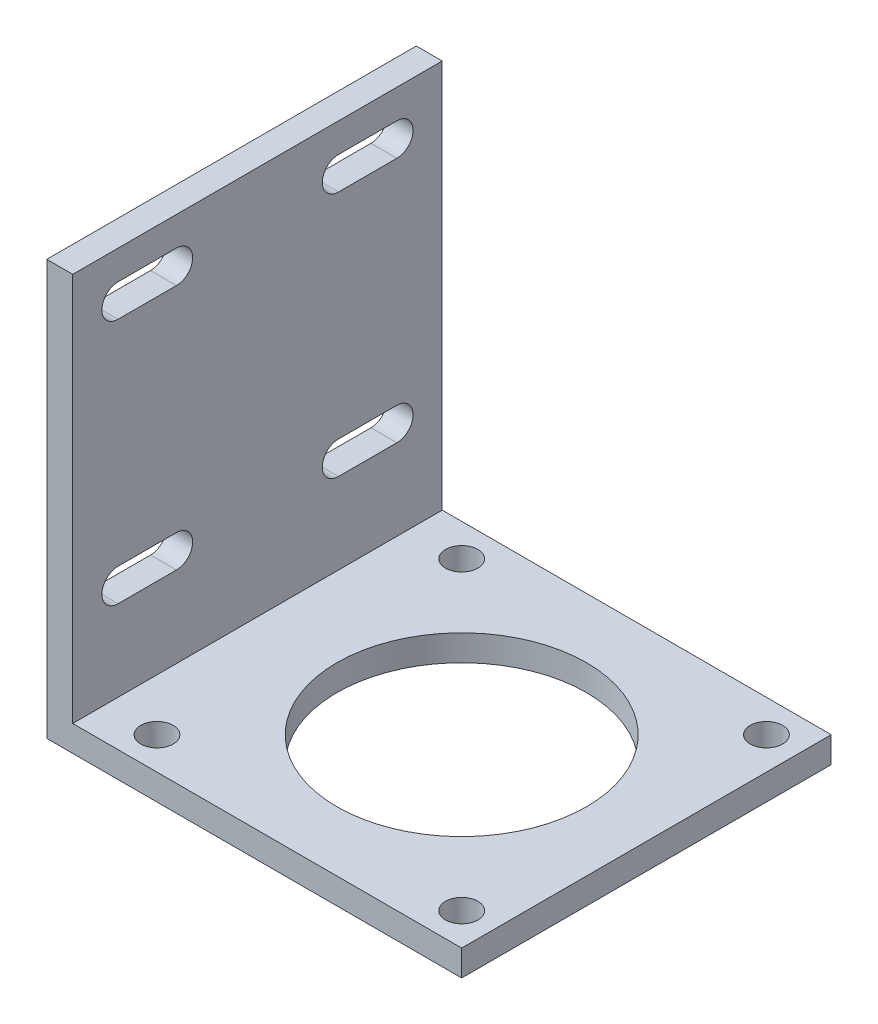
from build123d import *

# Parameters (mm, degrees)
SKETCH1_W                = 64
SKETCH1_H                = 57
BOSS_EXTRUDE1_DEPTH      = 4
SKETCH2_W                = 4
SKETCH2_H                = 57
BOSS_EXTRUDE2_DEPTH      = 60
SKETCH3_R                = 19.25
CUT_EXTRUDE1_DEPTH       = 60
F_5_0_5_DIAMETER_HOLE1_D = 5
CUT_EXTRUDE2_DEPTH       = 60


with BuildPart() as part:
    # Sketch1 → Boss-Extrude1 (new body)
    with BuildSketch(Plane(origin=(0, 0, 0), x_dir=(1, 0, 0), z_dir=(0, 1, 0))):
        Rectangle(SKETCH1_W, SKETCH1_H)
    extrude(amount=BOSS_EXTRUDE1_DEPTH)

    # Sketch2 → Boss-Extrude2 (add)
    with BuildSketch(Plane(origin=(0, 4, 0), x_dir=(1, 0, 0), z_dir=(0, 1, 0))):
        with Locations((-30, 0)):
            Rectangle(SKETCH2_W, SKETCH2_H)
    extrude(amount=BOSS_EXTRUDE2_DEPTH)

    # Sketch3 → Cut-Extrude1 (cut)
    with BuildSketch(Plane.XZ):
        with Locations(Location((3.5, 0, 0), (0, 0, 270))):
            Circle(SKETCH3_R)
    extrude(amount=-CUT_EXTRUDE1_DEPTH, mode=Mode.SUBTRACT)

    # Ø5.0 (5) Diameter Hole1 (through all)
    with Locations(Plane(origin=(0, 0, 0), x_dir=(-1, 0, 0), z_dir=(0, -1, 0))):
        with Locations((-27, -23.5), (-27, 23.5), (20, 23.5), (20, -23.5)):
            Hole(F_5_0_5_DIAMETER_HOLE1_D / 2)

    # Sketch6 → Cut-Extrude2 (cut)
    with BuildSketch(Plane.ZY.offset(32)):
        with BuildLine():
            Line((-21.5, 16.5), (-12.5, 16.5))
            ThreePointArc((-12.5, 16.5), (-10, 19), (-12.5, 21.5))
            Line((-12.5, 21.5), (-21.5, 21.5))
            ThreePointArc((-21.5, 21.5), (-24, 19), (-21.5, 16.5))
        make_face()
        with BuildLine():
            Line((12.5, 16.5), (21.5, 16.5))
            ThreePointArc((21.5, 16.5), (24, 19), (21.5, 21.5))
            Line((21.5, 21.5), (12.5, 21.5))
            ThreePointArc((12.5, 21.5), (10, 19), (12.5, 16.5))
        make_face()
        with BuildLine():
            Line((-21.5, 54.5), (-12.5, 54.5))
            ThreePointArc((-12.5, 54.5), (-10, 57), (-12.5, 59.5))
            Line((-12.5, 59.5), (-21.5, 59.5))
            ThreePointArc((-21.5, 59.5), (-24, 57), (-21.5, 54.5))
        make_face()
        with BuildLine():
            Line((12.5, 54.5), (21.5, 54.5))
            ThreePointArc((21.5, 54.5), (24, 57), (21.5, 59.5))
            Line((21.5, 59.5), (12.5, 59.5))
            ThreePointArc((12.5, 59.5), (10, 57), (12.5, 54.5))
        make_face()
    extrude(amount=-CUT_EXTRUDE2_DEPTH, mode=Mode.SUBTRACT)


solid = part.part
